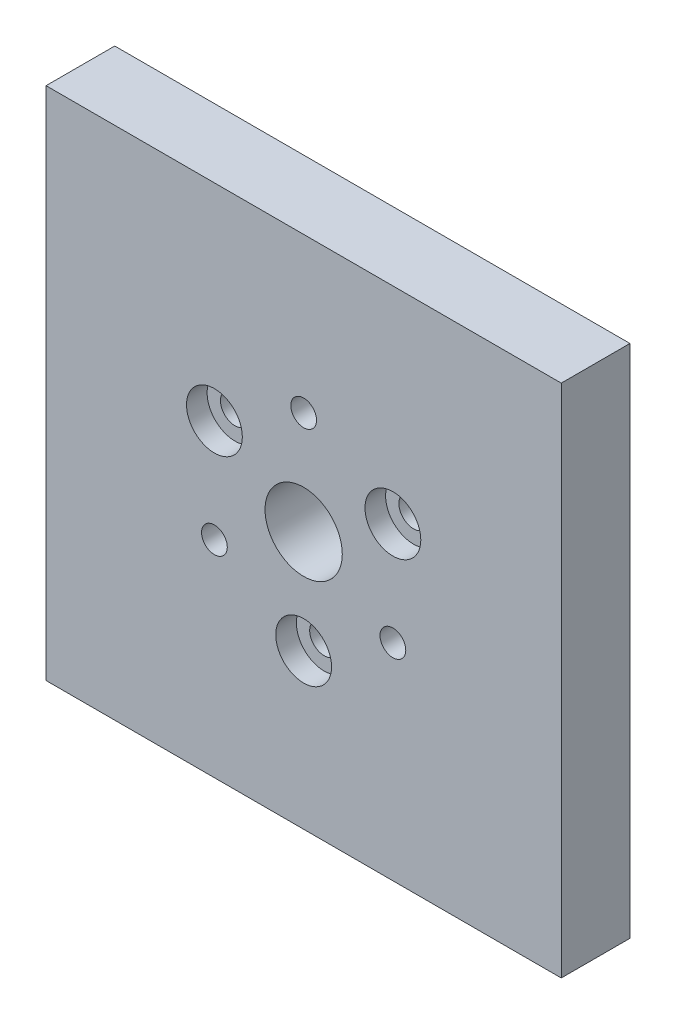
from build123d import *

# Parameters (mm, degrees)
SKETCH1_W                                            = 60
SKETCH1_H                                            = 60
BOSS_EXTRUDE1_DEPTH                                  = 8
M8_CLEARANCE_HOLE1_D                                 = 9
F_3_0MM_DOWEL_HOLE1_D                                = 3
CBORE_FOR_M3_HEX_SOCKET_THIN_HEAD_CAP_SC_D           = 3.4
CBORE_FOR_M3_HEX_SOCKET_THIN_HEAD_CAP_SC_CBORE_D     = 6.5
CBORE_FOR_M3_HEX_SOCKET_THIN_HEAD_CAP_SC_CBORE_DEPTH = 2.4


with BuildPart() as part:
    # Sketch1 → Boss-Extrude1 (new body)
    with BuildSketch(Plane.XY):
        with Locations((30, 30)):
            Rectangle(SKETCH1_W, SKETCH1_H)
    extrude(amount=BOSS_EXTRUDE1_DEPTH)

    # M8 Clearance Hole1 (through all)
    with Locations(Plane.XY.offset(8)):
        with Locations((30, 30)):
            Hole(M8_CLEARANCE_HOLE1_D / 2)

    # Ø3.0mm Dowel Hole1 (through all)
    with Locations(Plane.XY.offset(8)):
        with Locations((19.607695155, 24), (30, 42), (40.392304845, 24)):
            Hole(F_3_0MM_DOWEL_HOLE1_D / 2)

    # CBORE for M3 Hex Socket Thin Head Cap Screw1 (through all)
    with Locations(Plane.XY.offset(8)):
        with Locations((40.392304845, 36), (30, 18), (19.607695155, 36)):
            CounterBoreHole(CBORE_FOR_M3_HEX_SOCKET_THIN_HEAD_CAP_SC_D / 2, CBORE_FOR_M3_HEX_SOCKET_THIN_HEAD_CAP_SC_CBORE_D / 2, CBORE_FOR_M3_HEX_SOCKET_THIN_HEAD_CAP_SC_CBORE_DEPTH)


solid = part.part
